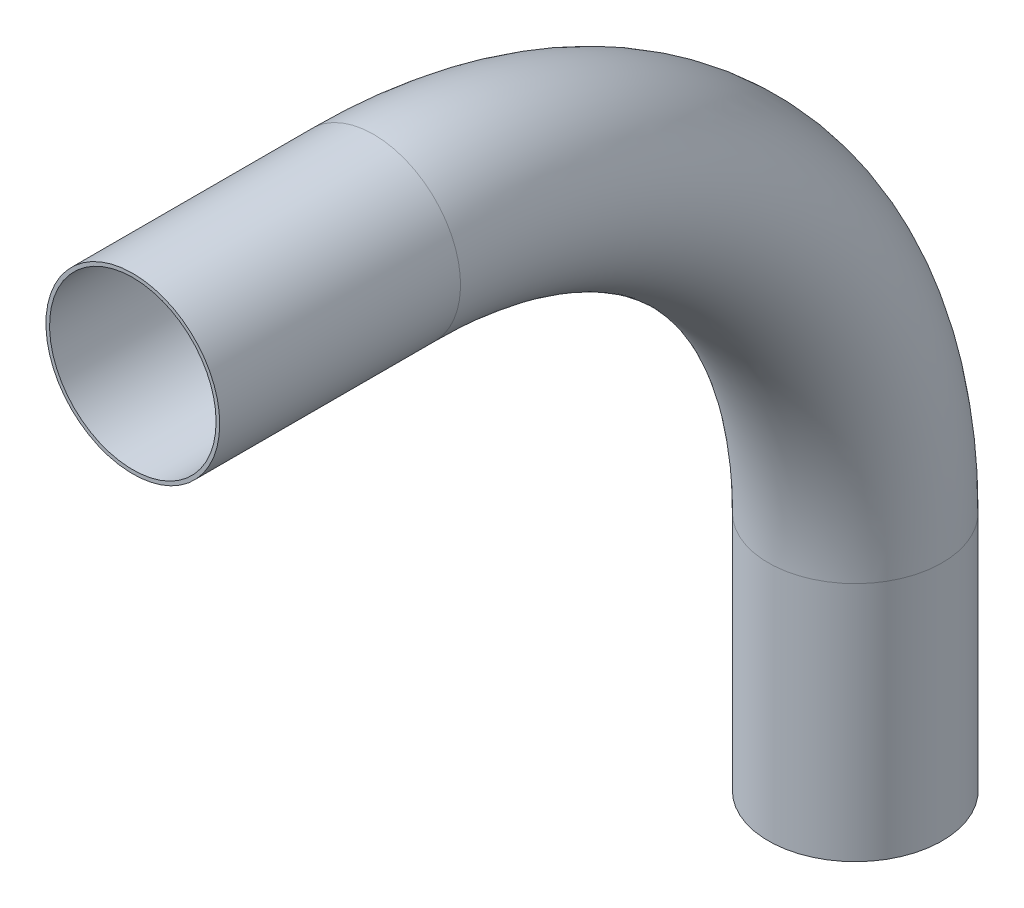
from build123d import *

# Parameters (mm, degrees)
SKETCH1_R        = 55
SKETCH1_R_2      = 52.7
EXTRUSION1_DEPTH = 152.4
SKETCH2_R        = 55
SKETCH2_R_2      = 52.7
SKETCH4_R        = 55
SKETCH4_R_2      = 52.7
EXTRUSION2_DEPTH = 152.4


with BuildPart() as part:
    # Sketch1 → Extrusion1 (new body)
    with BuildSketch(Plane(origin=(0, 0, 0), x_dir=(-1, 0, 0), z_dir=(0, 1, 0))):
        with Locations(Location((0, 0, 0), (0, 0, 270))):
            Circle(SKETCH1_R)
        with Locations(Location((0, 0, 0), (0, 0, 270))):
            Circle(SKETCH1_R_2, mode=Mode.SUBTRACT)
    extrude(amount=EXTRUSION1_DEPTH)

    # Sweep1: sweep along a path in Sketch3
    with BuildLine(Plane(origin=(-55, 152.4, 0), x_dir=(0, -1, 0), z_dir=(-1, 0, 0))) as sweep1_path:
        ThreePointArc((-304.8, 304.8), (-215.526146906, 89.273853094), (0, 0))
    # Sketch2 → Sweep1 (sweep)
    with BuildSketch(Plane(origin=(0, 152.4, 0), x_dir=(1, 0, 0), z_dir=(0, 1, 0))):
        Circle(SKETCH2_R)
        Circle(SKETCH2_R_2, mode=Mode.SUBTRACT)
    sweep(path=sweep1_path.line)

    # Sketch4 → Extrusion2 (add)
    with BuildSketch(Plane(origin=(0, 457.2, 304.8), x_dir=(1, 0, 0), z_dir=(0, 0, 1))):
        with Locations(Location((0, 0, 0), (0, 0, 90))):
            Circle(SKETCH4_R)
        with Locations(Location((0, 0, 0), (0, 0, 90))):
            Circle(SKETCH4_R_2, mode=Mode.SUBTRACT)
    extrude(amount=EXTRUSION2_DEPTH)


solid = part.part
